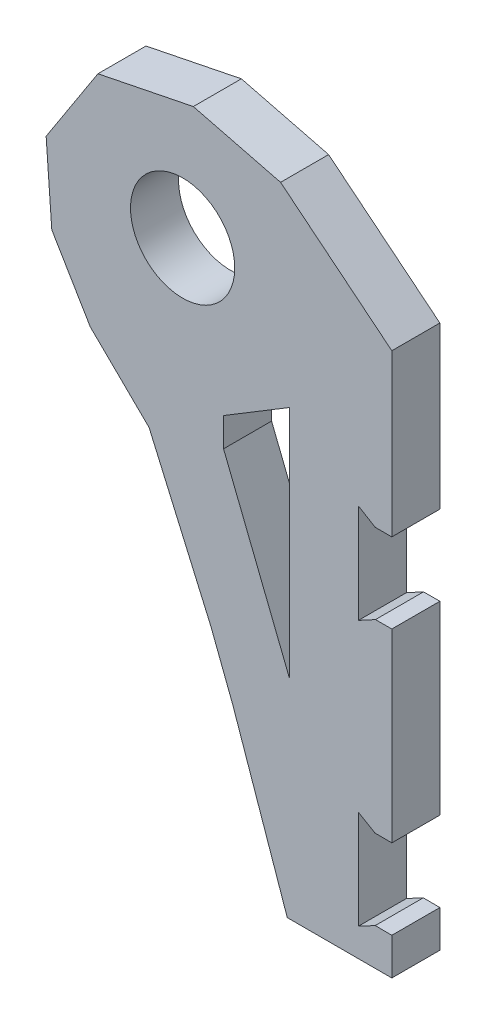
from build123d import *

# Parameters (mm, degrees)
SKETCH_1_R      = 8.137429072
EXTRUDE_1_DEPTH = 7.5


with BuildPart() as part:
    # 草图1 → 凸台-拉伸1 (new body)
    with BuildSketch(Plane.XY):
        Polygon((10.655742112, -51.13350276), (26.975655976, -51.132648268), (26.975655976, -45.355975578), (24.381633836, -45.338595321), (21.754811222, -46.744598553), (21.754811222, -31.335745249), (24.341110056, -32.847488843), (26.975655976, -32.865266967), (26.975655976, -3.94984418), (24.423395969, -3.952666276), (21.754811222, -5.399476315), (21.754811222, 10.078826219), (24.3888497, 8.498393016), (26.975655976, 8.501001852), (26.975655976, 14.3375467), (26.975655976, 33.668056688), (9.607760849, 47.75359746), (-4.011253891, 51.18832036), (-18.902979431, 48.177822313), (-26.990082321, 35.687740526), (-26.106294212, 23.478023729), (-20.096405563, 13.353512011), (-10.914003906, 4.339931688), (-1.275932846, -17.697925367), (2.140880051, -26.591846266), align=None)
        with Locations((-5.684087388, 32.581137097)):
            Circle(SKETCH_1_R, mode=Mode.SUBTRACT)
        Polygon((0.706809044, 7.273735046), (0.706809044, 11.775535583), (11.016924858, 18.016654968), (11.016924858, -18.659224532), align=None, mode=Mode.SUBTRACT)
    extrude(amount=EXTRUDE_1_DEPTH)


solid = part.part
